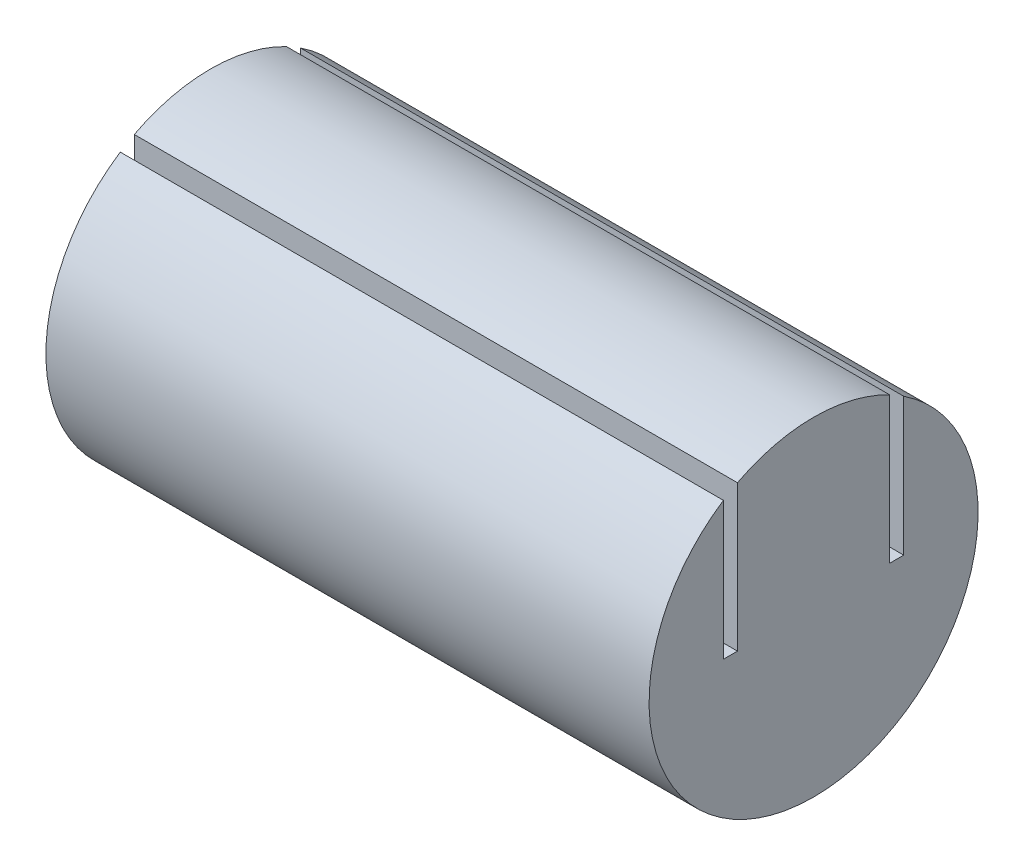
from build123d import *

# Parameters (mm, degrees)
BOSS_EXTRUDE1_DEPTH = 34.925


with BuildPart() as part:
    # Sketch1 → Boss-Extrude1 (new body)
    with BuildSketch(Plane(origin=(0, 0, 0), x_dir=(0, 0, -1), z_dir=(1, 0, 0))):
        with BuildLine():
            Line((-4.4069, 8.444220354), (-4.4069, 0))
            Line((-4.4069, 0), (4.4069, 0))
            Line((4.4069, 0), (4.4069, 8.444220354))
            ThreePointArc((4.4069, 8.444220354), (0, 9.525), (-4.4069, 8.444220354))
        make_face()
        with BuildLine():
            Line((4.4069, 0), (-4.4069, 0))
            Line((-4.4069, 0), (-5.2197, 0))
            Line((-5.2197, 0), (-5.2197, 7.967456113))
            ThreePointArc((-5.2197, 7.967456113), (-4.528133307, -8.379834948), (9.525, 0))
            ThreePointArc((9.525, 0), (8.379834948, 4.528133307), (5.2197, 7.967456113))
            Line((5.2197, 7.967456113), (5.2197, 0))
            Line((5.2197, 0), (4.4069, 0))
        make_face()
    extrude(amount=BOSS_EXTRUDE1_DEPTH)


solid = part.part
